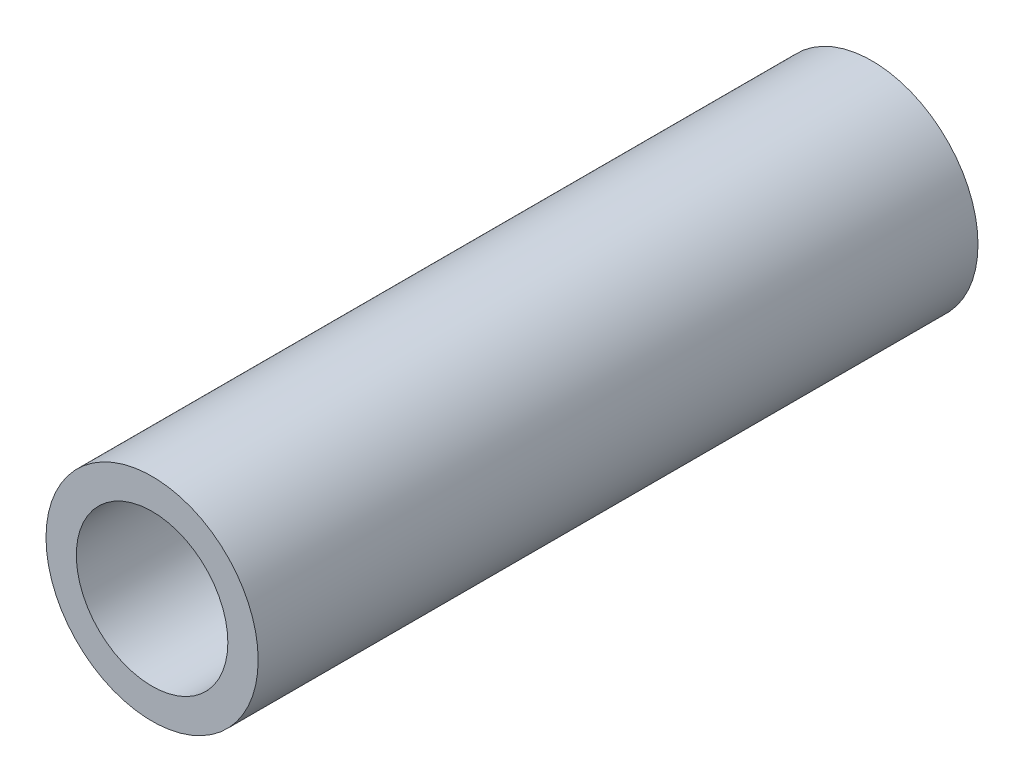
from build123d import *

# Parameters (mm, degrees)
SKETCH1_R           = 14
SKETCH1_R_2         = 10
BOSS_EXTRUDE1_DEPTH = 95


with BuildPart() as part:
    # Sketch1 → Boss-Extrude1 (new body)
    with BuildSketch(Plane.XY):
        Circle(SKETCH1_R)
        Circle(SKETCH1_R_2, mode=Mode.SUBTRACT)
    extrude(amount=BOSS_EXTRUDE1_DEPTH)


solid = part.part
